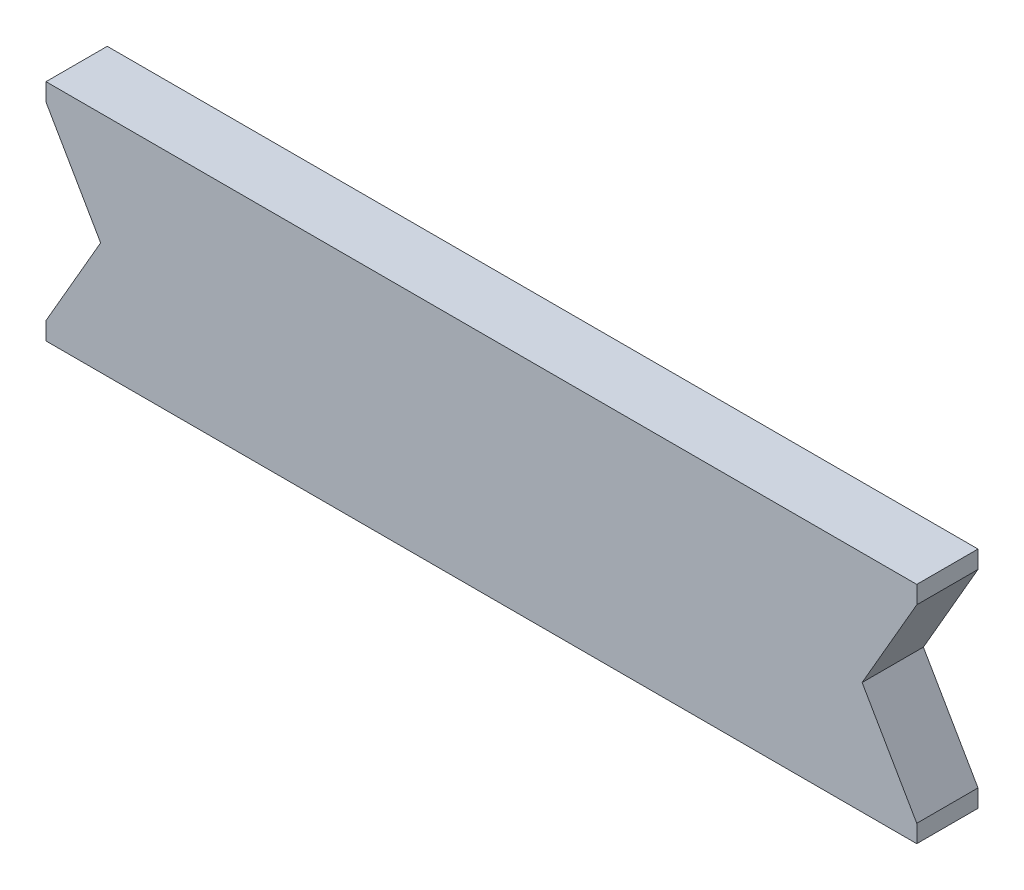
from build123d import *

# Parameters (mm, degrees)
BOSS_EXTRUDE1_DEPTH = 1.5
SKETCH3_W           = 0.25
SKETCH3_H           = 5.5
CUT_EXTRUDE1_DEPTH  = 12.352995302


with BuildPart() as part:
    # Sketch2 → Boss-Extrude1 (new body)
    with BuildSketch(Plane.XY):
        Polygon((-10.91228676, 2.75), (-9.324573519, 0), (-10.91228676, -2.75), (10.91228676, -2.75), (9.324573519, 0), (10.91228676, 2.75), align=None)
    extrude(amount=BOSS_EXTRUDE1_DEPTH)

    # Sketch3 → Cut-Extrude1 (cut, through all)
    with BuildSketch(Plane.XY.offset(1.5)):
        with Locations((10.78728676, 0)):
            Rectangle(SKETCH3_W, SKETCH3_H)
        with Locations((-10.78728676, 0)):
            Rectangle(SKETCH3_W, SKETCH3_H)
    extrude(amount=-CUT_EXTRUDE1_DEPTH, mode=Mode.SUBTRACT)


solid = part.part
